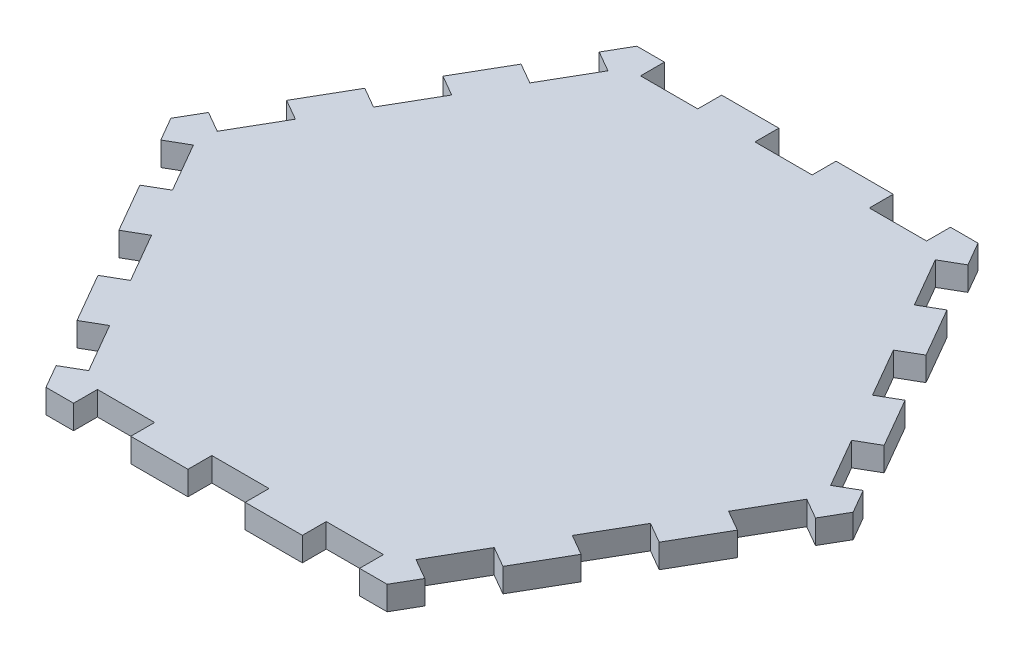
from build123d import *

# Parameters (mm, degrees)
BOSS_EXTRUDE3_DEPTH = 3.2


with BuildPart() as part:
    # Sketch1 → Boss-Extrude3 (new body)
    with BuildSketch(Plane(origin=(0, 0, 0), x_dir=(1, 0, 0), z_dir=(0, 1, 0))):
        Polygon((-22.869998863, -39.612), (-19.17495714, -39.612), (-19.17495714, -36.412), (-11.504974284, -36.412), (-11.504974284, -39.612), (-3.834991428, -39.612), (-3.834991428, -36.412), (3.834991428, -36.412), (3.834991428, -39.612), (11.504974284, -39.612), (11.504974284, -36.412), (19.17495714, -36.412), (19.17495714, -39.612), (22.869998863, -39.612), (24.717519725, -36.412), (21.946238432, -34.812), (25.781229861, -28.1696), (28.552511153, -29.7696), (32.387502581, -23.1272), (29.616221289, -21.5272), (33.451212717, -14.8848), (36.222494009, -16.4848), (40.057485437, -9.8424), (37.286204145, -8.2424), (41.121195573, -1.6), (43.892476865, -3.2), (45.739997726, 0), (43.892476865, 3.2), (41.121195573, 1.6), (37.286204145, 8.2424), (40.057485437, 9.8424), (36.222494009, 16.4848), (33.451212717, 14.8848), (29.616221289, 21.5272), (32.387502581, 23.1272), (28.552511153, 29.7696), (25.781229861, 28.1696), (21.946238432, 34.812), (24.717519725, 36.412), (22.869998863, 39.612), (19.17495714, 39.612), (19.17495714, 36.412), (11.504974284, 36.412), (11.504974284, 39.612), (3.834991428, 39.612), (3.834991428, 36.412), (-3.834991428, 36.412), (-3.834991428, 39.612), (-11.504974284, 39.612), (-11.504974284, 36.412), (-19.17495714, 36.412), (-19.17495714, 39.612), (-22.869998863, 39.612), (-24.717519725, 36.412), (-21.946238432, 34.812), (-25.781229861, 28.1696), (-28.552511153, 29.7696), (-32.387502581, 23.1272), (-29.616221289, 21.5272), (-33.451212717, 14.8848), (-36.222494009, 16.4848), (-40.057485437, 9.8424), (-37.286204145, 8.2424), (-41.121195573, 1.6), (-43.892476865, 3.2), (-45.739997726, 0), (-43.892476865, -3.2), (-41.121195573, -1.6), (-37.286204145, -8.2424), (-40.057485437, -9.8424), (-36.222494009, -16.4848), (-33.451212717, -14.8848), (-29.616221289, -21.5272), (-32.387502581, -23.1272), (-28.552511153, -29.7696), (-25.781229861, -28.1696), (-21.946238432, -34.812), (-24.717519725, -36.412), align=None)
    extrude(amount=BOSS_EXTRUDE3_DEPTH)


solid = part.part
